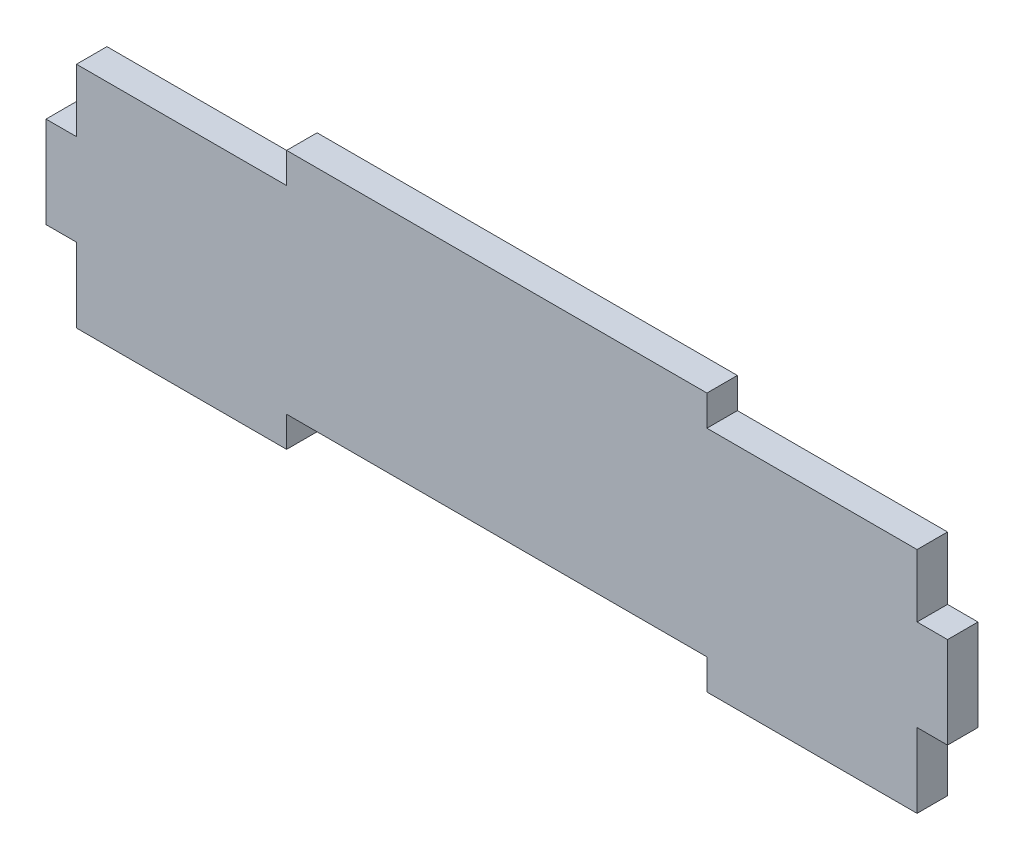
from build123d import *

# Parameters (mm, degrees)
BOSS_EXTRUDE4_DEPTH = 2


with BuildPart() as part:
    # Sketch1 → Boss-Extrude4 (new body)
    with BuildSketch(Plane.XY):
        Polygon((13.795467901, 0), (27.590935802, 0), (27.590935802, 4.881093546), (29.590935802, 4.881093546), (29.590935802, 10.881093546), (27.590935802, 10.881093546), (27.590935802, 15), (13.795467901, 15), (13.795467901, 17), (-13.795467901, 17), (-13.795467901, 15), (-27.590935802, 15), (-27.590935802, 10.881093546), (-29.590935802, 10.881093546), (-29.590935802, 4.881093546), (-27.590935802, 4.881093546), (-27.590935802, 0), (-13.795467901, 0), (-13.795467901, 2), (13.795467901, 2), align=None)
    extrude(amount=BOSS_EXTRUDE4_DEPTH)


solid = part.part
